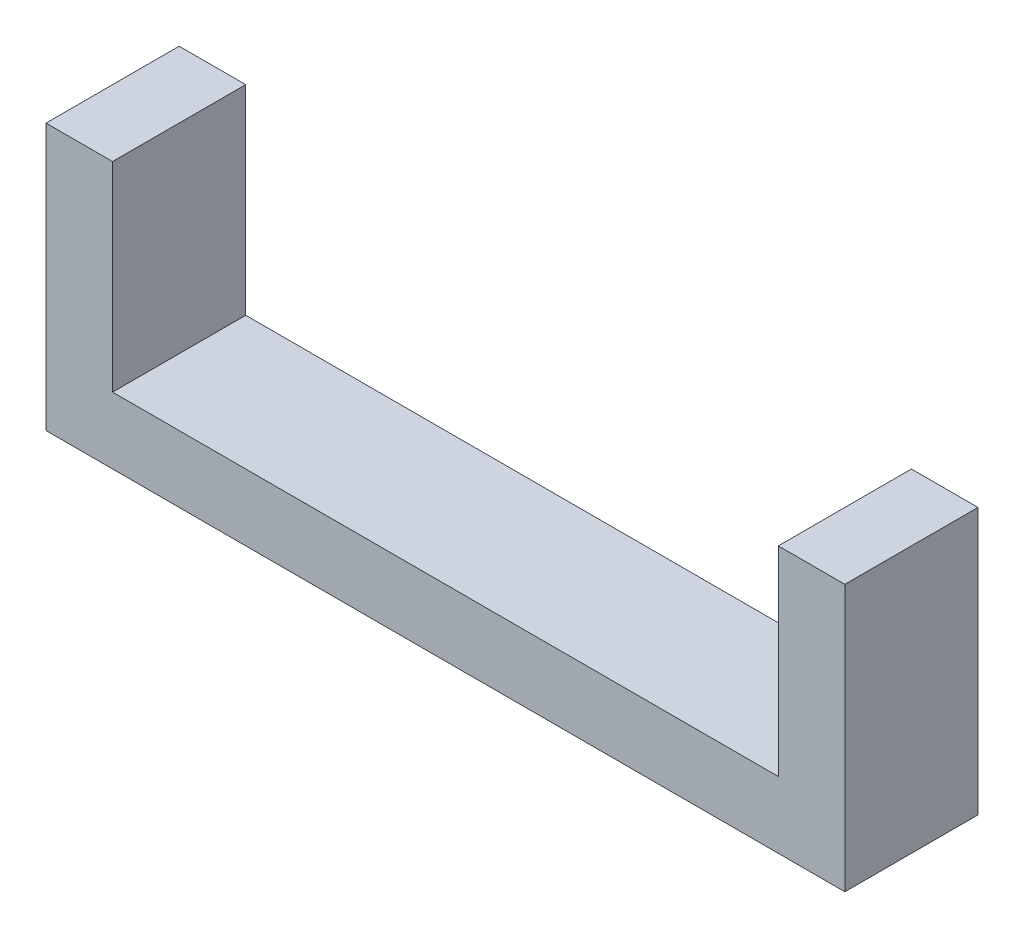
from build123d import *

# Parameters (mm, degrees)
BOSS_EXTRUDE1_DEPTH = 12.7


with BuildPart() as part:
    # Sketch1 → Boss-Extrude1 (new body)
    with BuildSketch(Plane.XY):
        Polygon((-38.1, 0), (38.1, 0), (38.1, 25.4), (31.75, 25.4), (31.75, 6.35), (-31.75, 6.35), (-31.75, 25.4), (-38.1, 25.4), align=None)
    extrude(amount=BOSS_EXTRUDE1_DEPTH)


solid = part.part
